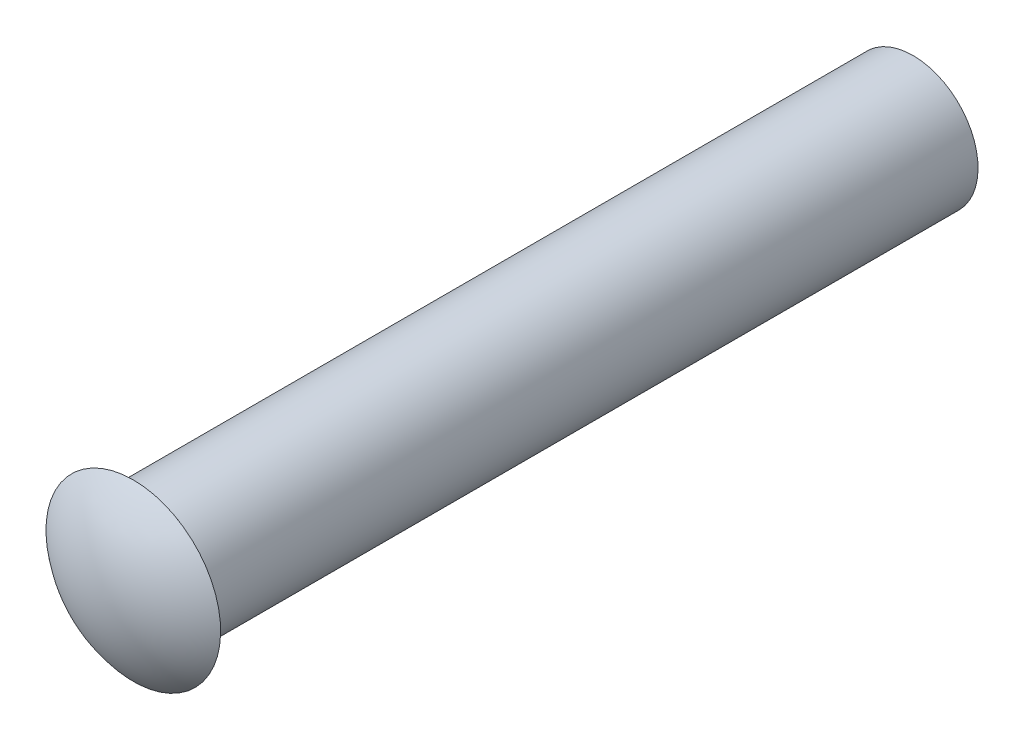
from build123d import *


with BuildPart() as part:
    # Sketch1 → Revolve1 (revolve)
    with BuildSketch(Plane(origin=(0, 0, 0), x_dir=(0, 0, -1), z_dir=(1, 0, 0))):
        with BuildLine():
            Line((19.8374, 0), (0, 0))
            ThreePointArc((0, 0), (0.203131612, 1.13712881), (0.7874, 2.1336))
            Line((0.7874, 2.1336), (0.7874, 1.5875))
            Line((0.7874, 1.5875), (19.8374, 1.5875))
            Line((19.8374, 1.5875), (19.8374, 0))
        make_face()
    revolve(axis=Axis((0, 0, -19.8374), (0, 0, 1)))


solid = part.part
